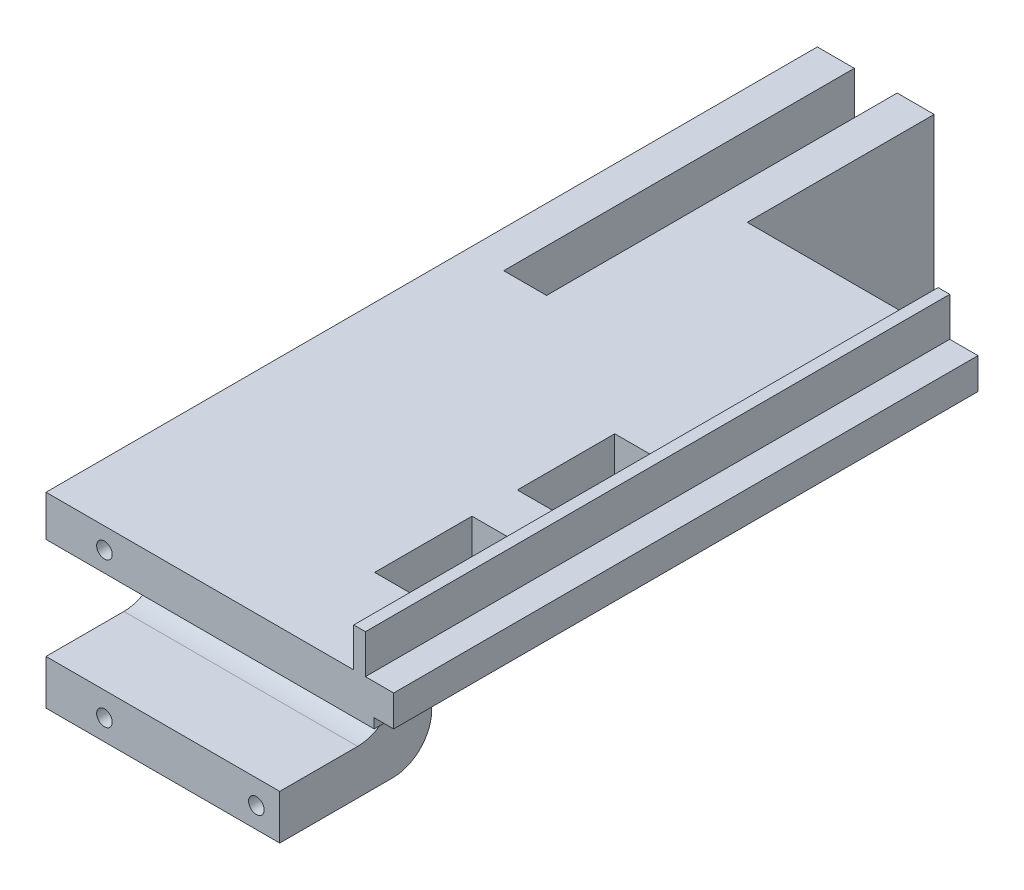
from build123d import *

# Parameters (mm, degrees)
CROQUIS1_W                 = 60
CROQUIS1_H                 = 48
SALIENTE_EXTRUIR1_DEPTH    = 6
CROQUIS4_W                 = 60
CROQUIS4_H                 = 11.5
SALIENTE_EXTRUIR3_DEPTH    = 30
CROQUIS5_R                 = 2
CORTAR_EXTRUIR3_DEPTH      = 16
CROQUIS6_W                 = 30
CROQUIS6_H                 = 48
SALIENTE_EXTRUIR4_DEPTH    = 162
CROQUIS7_R                 = 2
CORTAR_EXTRUIR4_DEPTH      = 16
CROQUIS11_W                = 150
CROQUIS11_H                = 11.5
SALIENTE_EXTRUIR6_DEPTH    = 59.25
CROQUIS12_W                = 3
CROQUIS12_H                = 150
SALIENTE_EXTRUIR7_DEPTH    = 10
CORTAR_EXTRUIR6_DEPTH      = 170.016303475
CORTAR_EXTRUIR6_DEPTH_BACK = 170.016303475
CROQUIS14_W                = 5
CROQUIS14_H                = 3.5
CORTAR_EXTRUIR7_DEPTH      = 213.768679181
CORTAR_EXTRUIR7_DEPTH_BACK = 90
CROQUIS15_W                = 11
CROQUIS15_H                = 11
CROQUIS16_W                = 30
CROQUIS16_H                = 1
CORTAR_EXTRUIR10_DEPTH     = 190.450484429
REDONDEO1_R                = 10
CROQUIS20_W                = 30
CROQUIS20_H                = 36.5
SALIENTE_EXTRUIR8_DEPTH    = 50
CROQUIS21_W                = 12
CROQUIS21_H                = 25
CORTAR_EXTRUIR11_DEPTH     = 40
CROQUIS22_W                = 30
CROQUIS22_H                = 36.5
CORTAR_EXTRUIR13_DEPTH     = 47
REDONDEO3_R                = 10


with BuildPart() as part:
    # Croquis1 → Saliente-Extruir1 (new body)
    with BuildSketch(Plane.XY):
        with Locations((-36.216216216, 7.011261261)):
            Rectangle(CROQUIS1_W, CROQUIS1_H)
    extrude(amount=SALIENTE_EXTRUIR1_DEPTH)

    # Croquis4 → Saliente-Extruir3 (add)
    with BuildSketch(Plane.XY.offset(6)):
        with Locations((-36.216216216, 25.261261261)):
            Rectangle(CROQUIS4_W, CROQUIS4_H)
        with Locations((-36.216216216, -11.238738739)):
            Rectangle(CROQUIS4_W, CROQUIS4_H)
    extrude(amount=SALIENTE_EXTRUIR3_DEPTH)

    # Croquis5 → Cortar-Extruir3 (cut)
    with BuildSketch(Plane.XY.offset(36)):
        with Locations((-51.216216216, 25.661261261)):
            Circle(CROQUIS5_R)
        with Locations((-12.216216216, 25.661261261)):
            Circle(CROQUIS5_R)
        with Locations((-12.216216216, -11.638738739)):
            Circle(CROQUIS5_R)
        with Locations((-51.216216216, -11.638738739)):
            Circle(CROQUIS5_R)
    extrude(amount=-CORTAR_EXTRUIR3_DEPTH, mode=Mode.SUBTRACT)

    # Croquis6 → Saliente-Extruir4 (add)
    with BuildSketch(Plane(origin=(0, 0, 0), x_dir=(-1, 0, 0), z_dir=(0, 0, -1))):
        with Locations((51.216216216, 7.011261261)):
            Rectangle(CROQUIS6_W, CROQUIS6_H)
    extrude(amount=SALIENTE_EXTRUIR4_DEPTH)

    # Croquis7 → Cortar-Extruir4 (cut)
    with BuildSketch(Plane(origin=(0, 0, -162), x_dir=(-1, 0, 0), z_dir=(0, 0, -1))):
        with Locations((51.216216216, 7.011261261)):
            Circle(CROQUIS7_R)
    extrude(amount=-CORTAR_EXTRUIR4_DEPTH, mode=Mode.SUBTRACT)

    # Croquis11 → Saliente-Extruir6 (add)
    with BuildSketch(Plane(origin=(-36.216216216, 0, 0), x_dir=(0, 0, -1), z_dir=(1, 0, 0))):
        with Locations((39, 25.261261261)):
            Rectangle(CROQUIS11_W, CROQUIS11_H)
    extrude(amount=SALIENTE_EXTRUIR6_DEPTH)

    # Croquis12 → Saliente-Extruir7 (add)
    with BuildSketch(Plane(origin=(0, 31.011261261, 0), x_dir=(1, 0, 0), z_dir=(0, 1, 0))):
        with Locations((14.283783784, 39)):
            Rectangle(CROQUIS12_W, CROQUIS12_H)
    extrude(amount=SALIENTE_EXTRUIR7_DEPTH)

    # Croquis14 → Cortar-Extruir6 (cut, two sides: drawn at the far end of the back side and taken through both)
    with BuildSketch(Plane(origin=(0, 0, -114), x_dir=(-1, 0, 0), z_dir=(0, 0, -1)).offset(-CORTAR_EXTRUIR6_DEPTH_BACK)):
        with Locations((-20.533783784, 21.261261261)):
            Rectangle(CROQUIS14_W, CROQUIS14_H)
    extrude(amount=CORTAR_EXTRUIR6_DEPTH + CORTAR_EXTRUIR6_DEPTH_BACK, mode=Mode.SUBTRACT)

    # Croquis15 → Cortar-Extruir7 (cut, two sides: drawn at the far end of the back side and taken through both)
    with BuildSketch(Plane(origin=(0, 0, -162), x_dir=(-1, 0, 0), z_dir=(0, 0, -1)).offset(-CORTAR_EXTRUIR7_DEPTH_BACK)):
        with Locations((51.216216216, 25.511261261)):
            Rectangle(CROQUIS15_W, CROQUIS15_H)
    extrude(amount=CORTAR_EXTRUIR7_DEPTH + CORTAR_EXTRUIR7_DEPTH_BACK, mode=Mode.SUBTRACT)

    # Croquis16 → Cortar-Extruir10 (cut, through all)
    with BuildSketch(Plane.ZY.offset(66.216216216)):
        with Locations((21, 20.011261261)):
            Rectangle(CROQUIS16_W, CROQUIS16_H)
    extrude(amount=-CORTAR_EXTRUIR10_DEPTH, mode=Mode.SUBTRACT)

    # Redondeo1
    redondeo1_edges = [part.edges().sort_by_distance(p)[0] for p in [
        (-36.216216216, -5.488738739, 6),
        (-24.091216216, 20.511261261, 6),
    ]]
    fillet(redondeo1_edges, radius=REDONDEO1_R)

    # Croquis20 → Saliente-Extruir8 (add)
    with BuildSketch(Plane(origin=(0, 0, 0), x_dir=(-1, 0, 0), z_dir=(0, 0, -1))):
        with Locations((21.216216216, 1.261261261)):
            Rectangle(CROQUIS20_W, CROQUIS20_H)
    extrude(amount=SALIENTE_EXTRUIR8_DEPTH)

    # Croquis21 → Cortar-Extruir11 (cut)
    with BuildSketch(Plane.XZ.offset(-19.511261261)):
        with Locations((-0.216216216, -0.858898944)):
            Rectangle(CROQUIS21_W, CROQUIS21_H)
        with Locations((-0.216216216, -37.5)):
            Rectangle(CROQUIS21_W, CROQUIS21_H)
    extrude(amount=-CORTAR_EXTRUIR11_DEPTH, mode=Mode.SUBTRACT)

    # Croquis22 → Cortar-Extruir13 (cut)
    with BuildSketch(Plane(origin=(0, 0, -50), x_dir=(-1, 0, 0), z_dir=(0, 0, -1))):
        with Locations((21.216216216, 1.261261261)):
            Rectangle(CROQUIS22_W, CROQUIS22_H)
    extrude(amount=-CORTAR_EXTRUIR13_DEPTH, mode=Mode.SUBTRACT)

    # Redondeo3
    redondeo3_edges = [part.edges().sort_by_distance(p)[0] for p in [
        (-21.216216216, -16.988738739, -3),
    ]]
    fillet(redondeo3_edges, radius=REDONDEO3_R)


solid = part.part
